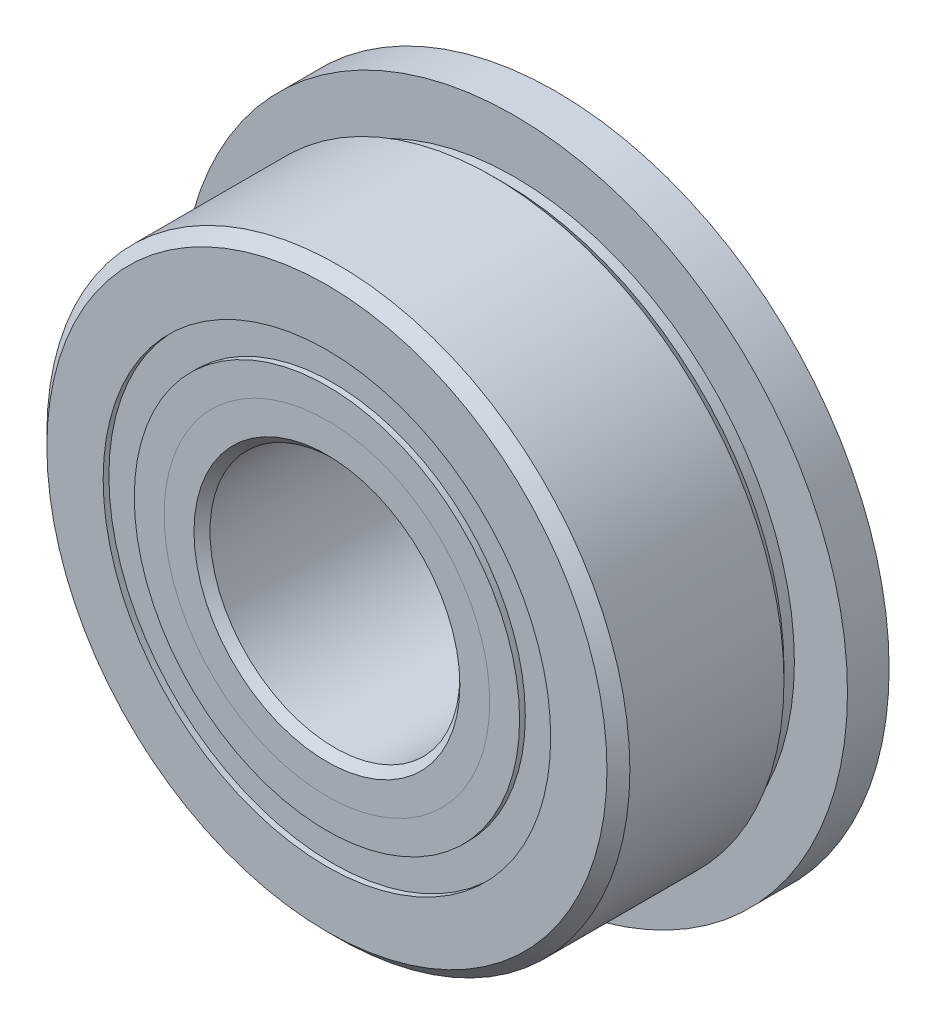
from build123d import *

# Parameters (mm, degrees)
SKETCH5_W         = 1.5875
SKETCH5_H         = 3.096715316
CIRPATTERN1_COUNT = 12
SKETCH7_W         = 1.583158032
SKETCH7_H         = 1.186263736
SKETCH7_H_2       = 2.574331868


with BuildPart() as part:
    # Sketch1 → Revolve1 (revolve)
    with BuildSketch(Plane(origin=(0, 0, 0), x_dir=(0, 0, -1), z_dir=(1, 0, 0))):
        with BuildLine():
            Line((3.9290625, 11.1125), (-3.9290625, 11.1125))
            Line((-3.9290625, 11.1125), (-4.365625, 10.6759375))
            Line((-4.365625, 10.6759375), (-4.365625, 8.530631868))
            Line((-4.365625, 8.530631868), (-2.494642857, 8.530631868))
            ThreePointArc((-2.494642857, 8.530631868), (0, 10.501685718), (2.494642857, 8.530631868))
            Line((2.494642857, 8.530631868), (4.365625, 8.530631868))
            Line((4.365625, 8.530631868), (4.365625, 10.6759375))
            Line((4.365625, 10.6759375), (3.9290625, 11.1125))
        make_face()
    revolve(axis=Axis((0, 0, 4.365625), (0, 0, -1)))

    # Sketch5 → Revolve5 (revolve)
    with BuildSketch(Plane(origin=(0, 0, 0), x_dir=(0, 0, -1), z_dir=(1, 0, 0))):
        with Locations((3.571875, 11.151642342)):
            Rectangle(SKETCH5_W, SKETCH5_H)
    revolve(axis=Axis((0, 0, -5.953125), (0, 0, 1)))

    # Sketch6 → Cut-Revolve1 (revolve, cut)
    with BuildSketch(Plane(origin=(0, 0, 0), x_dir=(0, 0, -1), z_dir=(1, 0, 0))):
        Polygon((1.9446875, 11.1125), (2.38125, 10.6759375), (2.778125, 10.6759375), (2.778125, 11.1125), align=None)
    revolve(axis=Axis((0, 0, 4.365625), (0, 0, -1)), mode=Mode.SUBTRACT)


with BuildPart() as body_2:
    # Sketch2 → Revolve2 (revolve)
    with BuildSketch(Plane(origin=(0, 0, 0), x_dir=(0, 0, -1), z_dir=(1, 0, 0))):
        with BuildLine():
            Line((-4.365625, 7.344368132), (-2.494642857, 7.344368132))
            ThreePointArc((-2.494642857, 7.344368132), (-1.589677347, 5.925542165), (0, 5.373314282))
            Line((0, 5.373314282), (0, 5.067907141))
            Line((0, 5.067907141), (-3.227394505, 5.067907141))
            Line((-3.227394505, 5.067907141), (-4.365625, 6.206137636))
            Line((-4.365625, 6.206137636), (-4.365625, 7.344368132))
        make_face()
    revolve(axis=Axis((0, 0, 4.365625), (0, 0, -1)))


with BuildPart() as body_3:
    # Sketch3 → Revolve3 (revolve)
    with BuildSketch(Plane(origin=(0, 0, 0), x_dir=(0, 0, -1), z_dir=(1, 0, 0))):
        with BuildLine():
            Line((-4.365625, 6.206137636), (-3.227394505, 5.067907141))
            Line((-3.227394505, 5.067907141), (0, 5.067907141))
            Line((0, 5.067907141), (0, 5.373314282))
            ThreePointArc((0, 5.373314282), (0.86454718, 5.523456386), (1.627849796, 5.9563))
            Line((1.627849796, 5.9563), (5.953125, 5.9563))
            Line((5.953125, 5.9563), (5.953125, 5.1990625))
            Line((5.953125, 5.1990625), (5.5165625, 4.7625))
            Line((5.5165625, 4.7625), (-4.060217859, 4.7625))
            Line((-4.060217859, 4.7625), (-4.365625, 5.067907141))
            Line((-4.365625, 5.067907141), (-4.365625, 6.206137636))
        make_face()
    revolve(axis=Axis((0, 0, 4.365625), (0, 0, -1)))


with BuildPart() as body_4:
    # Sketch4 → Revolve4 (revolve)
    with BuildSketch(Plane(origin=(0, 0, 0), x_dir=(0, 0, -1), z_dir=(1, 0, 0))):
        with BuildLine():
            Line((-2.564185718, 7.9375), (2.564185718, 7.9375))
            ThreePointArc((2.564185718, 7.9375), (0, 10.501685718), (-2.564185718, 7.9375))
        make_face()
    revolve(axis=Axis((0, 7.9375, 2.564185718), (0, 0, -1)))


with BuildPart() as cirpattern1_1:
    # CirPattern1: pattern copy
    add(body_4.part.rotate(Axis((0, 0, -4.365625), (0, 0, 1)), 1 * 360 / CIRPATTERN1_COUNT))


with BuildPart() as cirpattern1_2:
    # CirPattern1: pattern copy
    add(body_4.part.rotate(Axis((0, 0, -4.365625), (0, 0, 1)), 2 * 360 / CIRPATTERN1_COUNT))


with BuildPart() as cirpattern1_3:
    # CirPattern1: pattern copy
    add(body_4.part.rotate(Axis((0, 0, -4.365625), (0, 0, 1)), 3 * 360 / CIRPATTERN1_COUNT))


with BuildPart() as cirpattern1_4:
    # CirPattern1: pattern copy
    add(body_4.part.rotate(Axis((0, 0, -4.365625), (0, 0, 1)), 4 * 360 / CIRPATTERN1_COUNT))


with BuildPart() as cirpattern1_5:
    # CirPattern1: pattern copy
    add(body_4.part.rotate(Axis((0, 0, -4.365625), (0, 0, 1)), 5 * 360 / CIRPATTERN1_COUNT))


with BuildPart() as cirpattern1_6:
    # CirPattern1: pattern copy
    add(body_4.part.rotate(Axis((0, 0, -4.365625), (0, 0, 1)), 6 * 360 / CIRPATTERN1_COUNT))


with BuildPart() as cirpattern1_7:
    # CirPattern1: pattern copy
    add(body_4.part.rotate(Axis((0, 0, -4.365625), (0, 0, 1)), 7 * 360 / CIRPATTERN1_COUNT))


with BuildPart() as cirpattern1_8:
    # CirPattern1: pattern copy
    add(body_4.part.rotate(Axis((0, 0, -4.365625), (0, 0, 1)), 8 * 360 / CIRPATTERN1_COUNT))


with BuildPart() as cirpattern1_9:
    # CirPattern1: pattern copy
    add(body_4.part.rotate(Axis((0, 0, -4.365625), (0, 0, 1)), 9 * 360 / CIRPATTERN1_COUNT))


with BuildPart() as cirpattern1_10:
    # CirPattern1: pattern copy
    add(body_4.part.rotate(Axis((0, 0, -4.365625), (0, 0, 1)), 10 * 360 / CIRPATTERN1_COUNT))


with BuildPart() as cirpattern1_11:
    # CirPattern1: pattern copy
    add(body_4.part.rotate(Axis((0, 0, -4.365625), (0, 0, 1)), 11 * 360 / CIRPATTERN1_COUNT))


with BuildPart() as body_16:
    # Sketch7 → Revolve6 (revolve)
    with BuildSketch(Plane(origin=(0, 0, 0), x_dir=(0, 0, -1), z_dir=(1, 0, 0))):
        with Locations((-3.355764734, 7.9375)):
            Rectangle(SKETCH7_W, SKETCH7_H)
        with Locations((3.355764734, 7.243465934)):
            Rectangle(SKETCH7_W, SKETCH7_H_2)
    revolve(axis=Axis((0, 0, 4.365625), (0, 0, -1)))


solid = Compound([part.part, body_2.part, body_3.part, body_4.part, cirpattern1_1.part, cirpattern1_2.part, cirpattern1_3.part, cirpattern1_4.part, cirpattern1_5.part, cirpattern1_6.part, cirpattern1_7.part, cirpattern1_8.part, cirpattern1_9.part, cirpattern1_10.part, cirpattern1_11.part, body_16.part])
